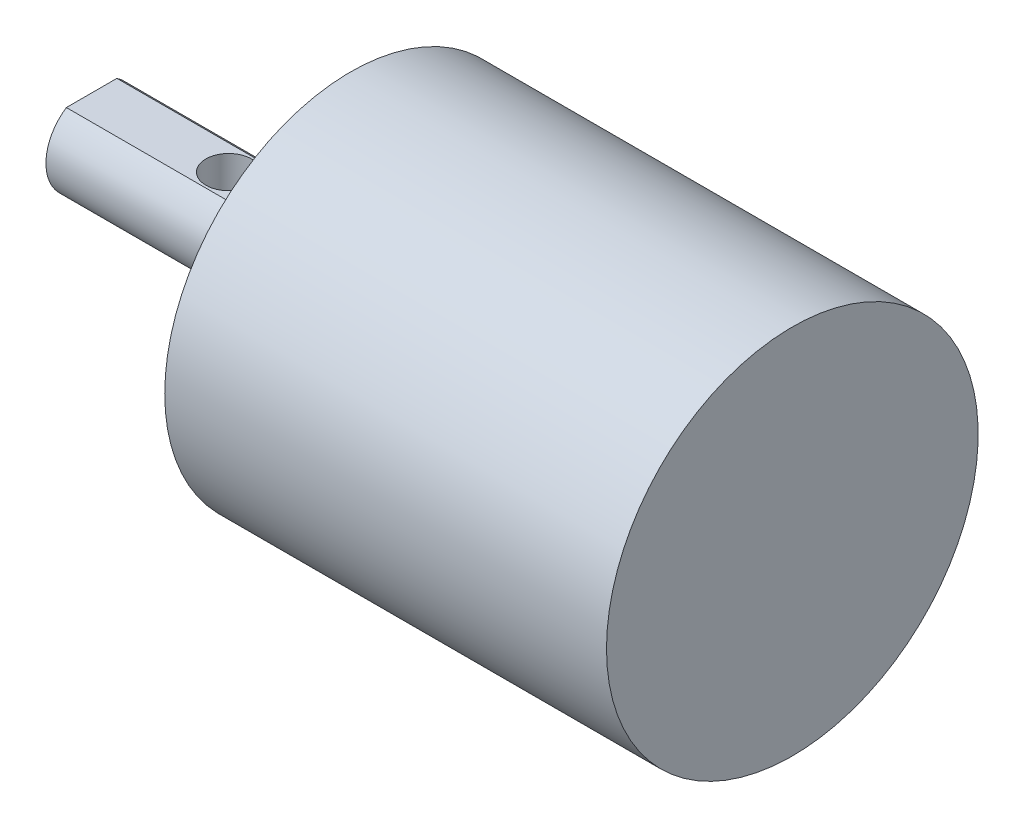
from build123d import *

# Parameters (mm, degrees)
CUT_EXTRUDE_3_DEPTH    = 11.5
HOLE_WIZARD_M3_1_D     = 2.5
HOLE_WIZARD_M3_1_DEPTH = 5.5
HOLE_WIZARD_M3_1_TIP   = 0.751075774
SKETCH_12_R            = 1.5
CUT_EXTRUDE_4_DEPTH    = 11.5
HOLE_WIZARD_M3_2_D     = 2.5
HOLE_WIZARD_M3_2_DEPTH = 4
HOLE_WIZARD_M3_2_TIP   = 0.751075774
EXTRUDE_START          = 0.5
EXTRUDE_1_DEPTH        = 0.5


with BuildPart() as part:
    # 草图1 → 旋转1 (revolve)
    with BuildSketch(Plane(origin=(0, 0, 0), x_dir=(1, 0, 0), z_dir=(0, 1, 0))):
        Polygon((0, 0), (-29, 0), (-29, 5.7), (-31.6, 5.7), (-31.6, 9.2), (-46, 9.2), (-46, 12.2), (0, 12.2), align=None)
    revolve(axis=Axis((-46, 0, -12.2), (1, 0, 0)))

    # 草图9 → 切除-拉伸3 (cut)
    with BuildSketch(Plane.ZY.offset(46)):
        with BuildLine():
            Line((-12.2, 2.5), (-10.541687605, 2.5))
            ThreePointArc((-10.541687605, 2.5), (-12.2, 3), (-13.858312395, 2.5))
            Line((-13.858312395, 2.5), (-12.2, 2.5))
        make_face()
    extrude(amount=-CUT_EXTRUDE_3_DEPTH, mode=Mode.SUBTRACT)

    # M3 螺纹孔1
    with Locations(Plane.ZY.offset(46)):
        with Locations((-12.2, 0)):
            Hole(HOLE_WIZARD_M3_1_D / 2, depth=HOLE_WIZARD_M3_1_DEPTH)
            with Locations((0, 0, -(HOLE_WIZARD_M3_1_DEPTH + HOLE_WIZARD_M3_1_TIP / 2))):  # 118° drill point
                Cone(0, HOLE_WIZARD_M3_1_D / 2, HOLE_WIZARD_M3_1_TIP, mode=Mode.SUBTRACT)

    # 草图12 → 切除-拉伸4 (cut)
    with BuildSketch(Plane(origin=(0, 2.5, 0), x_dir=(1, 0, 0), z_dir=(0, 1, 0))):
        with Locations(Location((-37, 12.2, 0), (0, 0, 270))):
            Circle(SKETCH_12_R)
    extrude(amount=-CUT_EXTRUDE_4_DEPTH, mode=Mode.SUBTRACT)

    # M3 螺纹孔2
    with Locations(Plane.ZY.offset(29)):
        with Locations((-12.2, 9.5), (-20.427241336, -4.75), (-3.972758664, -4.75)):
            Hole(HOLE_WIZARD_M3_2_D / 2, depth=HOLE_WIZARD_M3_2_DEPTH)
            with Locations((0, 0, -(HOLE_WIZARD_M3_2_DEPTH + HOLE_WIZARD_M3_2_TIP / 2))):  # 118° drill point
                Cone(0, HOLE_WIZARD_M3_2_D / 2, HOLE_WIZARD_M3_2_TIP, mode=Mode.SUBTRACT)

    # 草图16 → 凸台-拉伸1 (add)
    with BuildSketch(Plane.ZY.offset(31.6).offset(EXTRUDE_START)):
        with BuildLine():
            Line((-9.601923789, -1.5), (-12.2, -6))
            ThreePointArc((-12.2, -6), (-8.525765386, 4.74341649), (-18.009475019, -1.5))
            Line((-18.009475019, -1.5), (-14.69206472, 1.670213589))
            ThreePointArc((-14.69206472, 1.670213589), (-10.614007201, 2.546493048), (-9.601923789, -1.5))
        make_face()
    extrude(amount=-EXTRUDE_1_DEPTH)


solid = part.part
